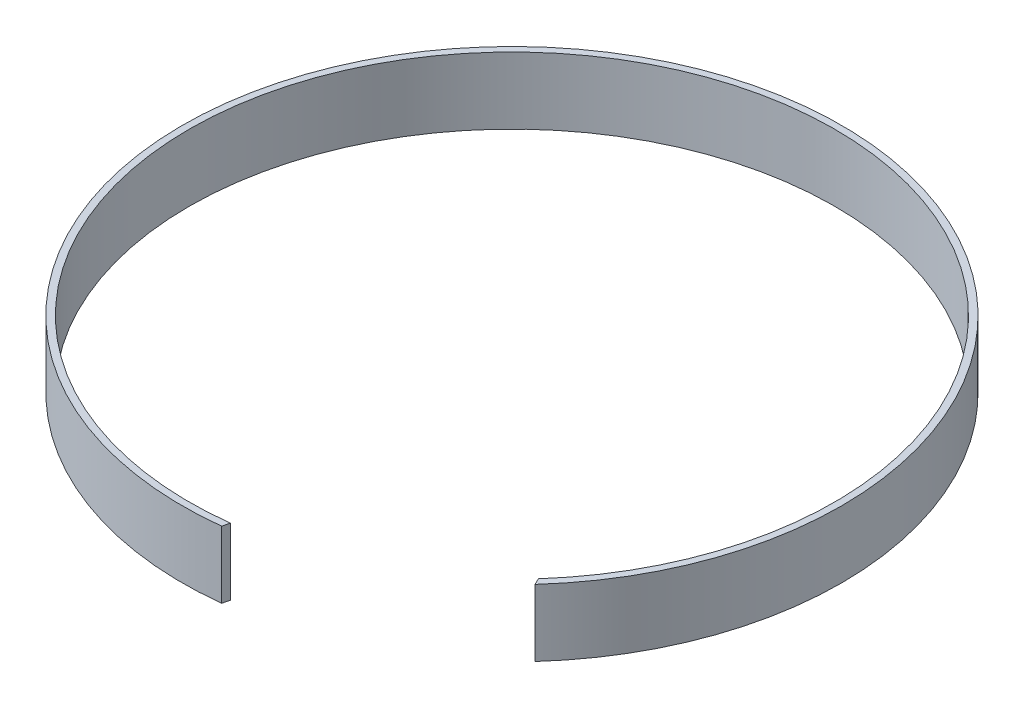
from build123d import *

# Parameters (mm, degrees)
BOSS_EXTRUDE1_DEPTH = 30


with BuildPart() as part:
    # Sketch1 → Boss-Extrude1 (new body)
    with BuildSketch(Plane(origin=(0, 0, 0), x_dir=(1, 0, 0), z_dir=(0, 1, 0))):
        with BuildLine():
            Line((17.468835001, -143.943877271), (16.738326472, -147.083592192))
            ThreePointArc((16.738326472, -147.083592192), (-67.572450298, 131.710738461), (109.70959104, -99.385916))
            Line((109.70959104, -99.385916), (108.311394553, -96.403536294))
            ThreePointArc((108.311394553, -96.403536294), (-67.232339999, 128.471056889), (17.468835001, -143.943877271))
        make_face()
    extrude(amount=BOSS_EXTRUDE1_DEPTH)


solid = part.part
